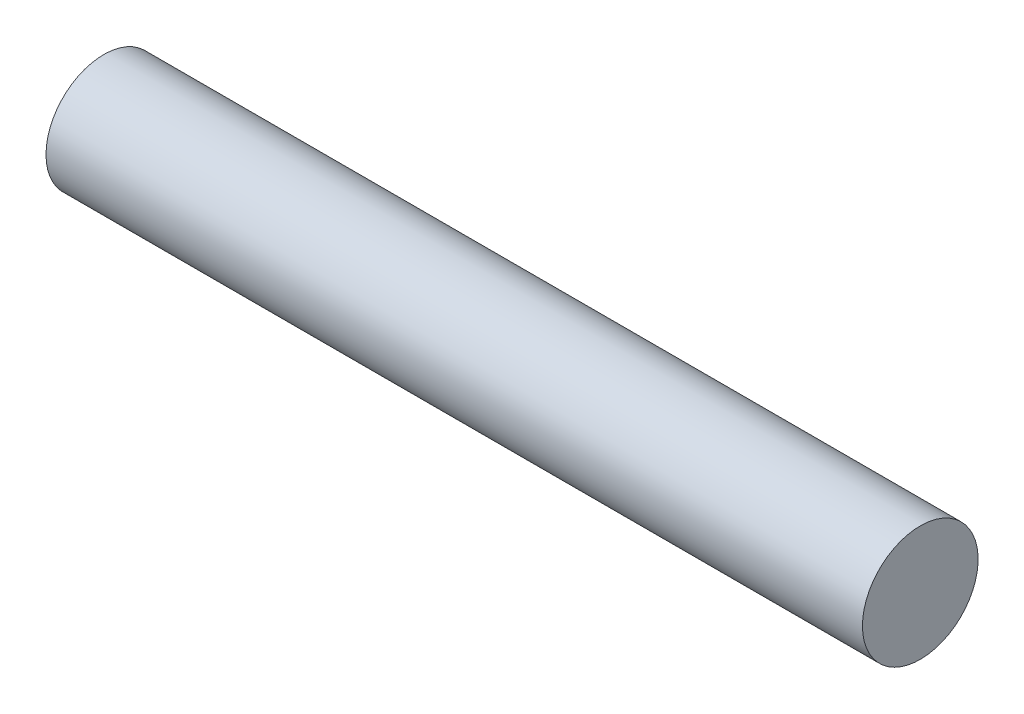
from build123d import *

# Parameters (mm, degrees)
ESQUISSE1_W = 240
ESQUISSE1_H = 17


with BuildPart() as part:
    # Esquisse1 → Révolution1 (revolve)
    with BuildSketch(Plane.XY, mode=Mode.PRIVATE) as r_volution1_sk:
        with Locations((120, 8.5)):
            Rectangle(ESQUISSE1_W, ESQUISSE1_H)
    revolve(r_volution1_sk.sketch.rotate(Axis((0, 0, 0), (1, 0, 0)), 90), axis=Axis((0, 0, 0), (1, 0, 0)))


solid = part.part
